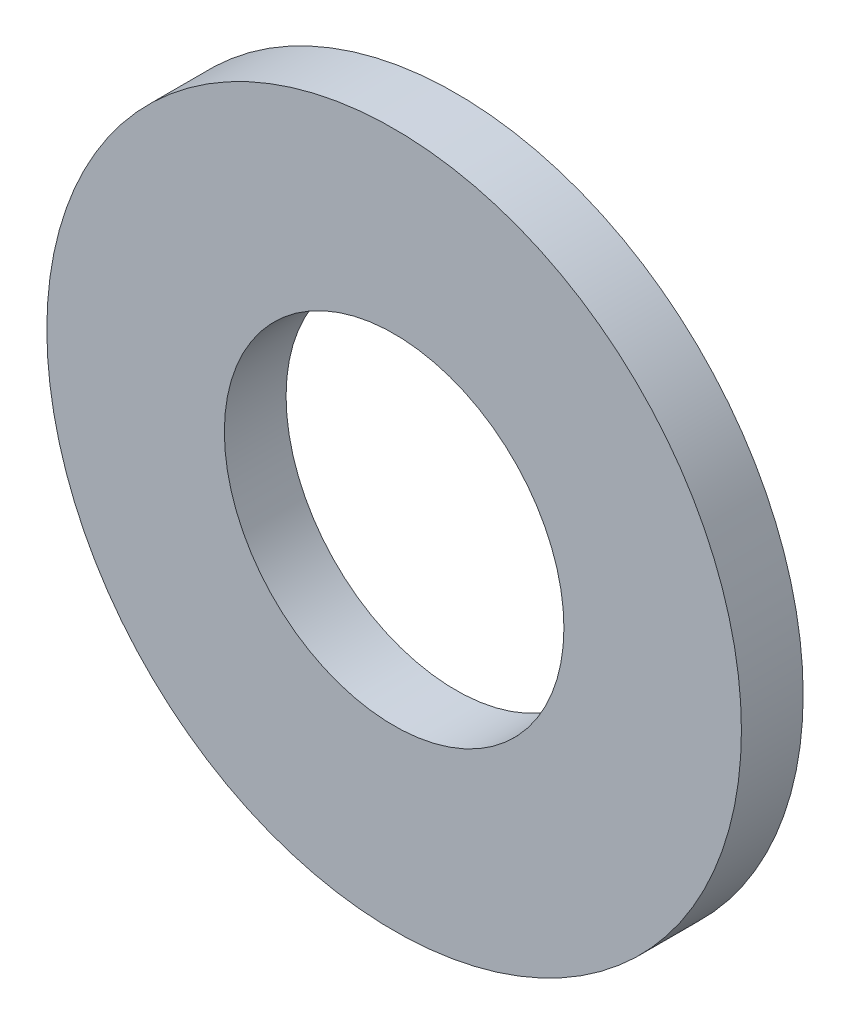
from build123d import *

# Parameters (mm, degrees)
SKETCH1_W = 2.3
SKETCH1_H = 0.8


with BuildPart() as part:
    # Sketch1 → Revolve1 (revolve)
    with BuildSketch(Plane.XZ, mode=Mode.PRIVATE) as revolve1_sk:
        with Locations((3.35, 0.4)):
            Rectangle(SKETCH1_W, SKETCH1_H)
    revolve(revolve1_sk.sketch.rotate(Axis((0, 0, 0.8), (0, 0, -1)), 180), axis=Axis((0, 0, 0.8), (0, 0, -1)))


solid = part.part
